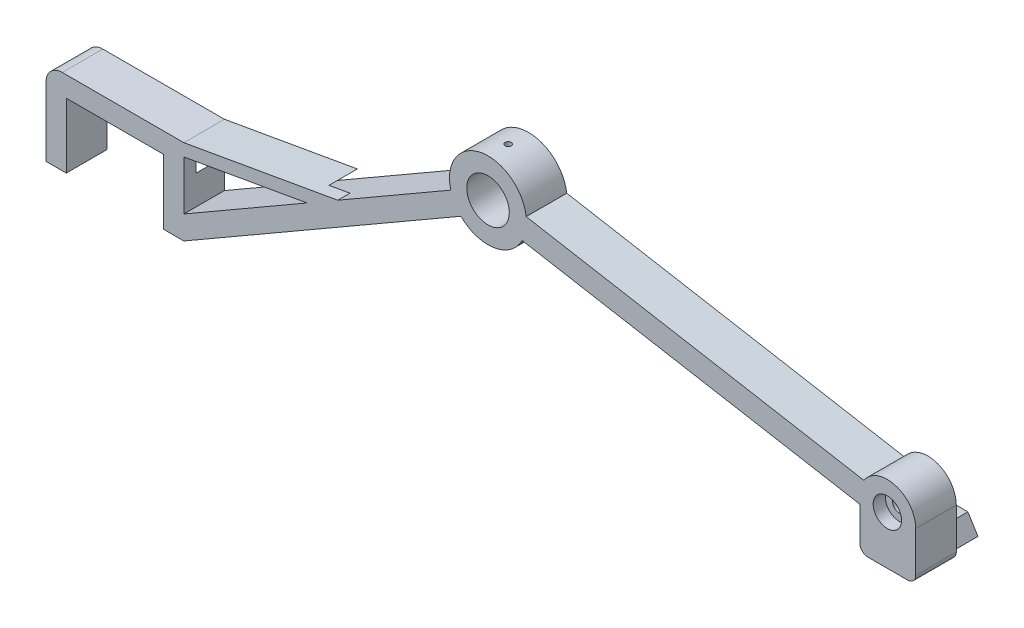
from build123d import *

# Parameters (mm, degrees)
SKICA1_R                 = 5.25
P_IDAT_VYSUNUT_M1_DEPTH  = 5
ZAOBLIT1_R               = 4
P_IDAT_VYSUNUT_M3_DEPTH  = 5
SKICA5_R                 = 4.25
SKICA5_R_2               = 1.75
P_IDAT_VYSUNUT_M4_DEPTH  = 1
SKICA8_R                 = 1.05
ODEBRAT_VYSUNUT_M3_DEPTH = 6
ODEBRAT_VYSUNUT_M4_DEPTH = 7
ODEBRAT_START            = -10
SKICA2_R                 = 1.75
ODEBRAT_VYSUNUT_M5_DEPTH = 10
SKICA10_R                = 3.5
ODEBRAT_VYSUNUT_M6_DEPTH = 3
ODEBRAT_START_2          = 50
SKICA11_R                = 0.75
ODEBRAT_VYSUNUT_M7_DEPTH = 10
P_IDAT_VYSUNUT_M5_DEPTH  = 10
P_IDAT_VYSUNUT_M6_DEPTH  = 8
ZAOBLIT2_R               = 2
ODEBRAT_START_3          = -7
ODEBRAT_VYSUNUT_M8_DEPTH = 7
SCALE1_SCALE             = 8


with BuildPart() as part:
    # Skica1 → Přidat vysunutím1 (new, symmetric)
    with BuildSketch(Plane.XY):
        with BuildLine():
            Line((0, 0), (0, 16))
            Line((0, 16), (24, 16))
            Line((24, 16), (24, 0))
            Line((24, 0), (29, 0))
            Line((29, 0), (97.312746067, 39.440382331))
            ThreePointArc((97.312746067, 39.440382331), (105.473420704, 36.802978572), (112.433277726, 41.81425579))
            Line((112.433277726, 41.81425579), (195.687578405, 27.134276321))
            ThreePointArc((195.687578405, 27.134276321), (209.374429572, 27.607666525), (196.674905514, 32.733686604))
            Line((196.674905514, 32.733686604), (113.420604835, 47.413666074))
            ThreePointArc((113.420604835, 47.413666074), (102.174688824, 55.511016714), (94.812746067, 43.77050935))
            Line((94.812746067, 43.77050935), (29, 5.773502692))
            Line((29, 5.773502692), (29, 21))
            Line((29, 21), (-5, 21))
            Line((-5, 21), (-5, 0))
            Line((-5, 0), (0, 0))
        make_face()
        with Locations((104, 46.188021535)):
            Circle(SKICA1_R, mode=Mode.SUBTRACT)
    extrude(amount=P_IDAT_VYSUNUT_M1_DEPTH, both=True)

    # Zaoblit1
    zaoblit1_edges = [part.edges().sort_by_distance(p)[0] for p in [
        (-5, 21, 0),
    ]]
    fillet(zaoblit1_edges, radius=ZAOBLIT1_R)

    # Skica4 → Přidat vysunutím3 (add, symmetric)
    with BuildSketch(Plane.XY):
        Polygon((29, 21), (66.969109888, 27.694978507), (59.37284323, 23.309271907), (29, 17.953720164), align=None)
    extrude(amount=P_IDAT_VYSUNUT_M3_DEPTH, both=True)

    # Skica5 → Přidat vysunutím4 (add)
    with BuildSketch(Plane.XY.offset(5)):
        with Locations((202.480775301, 28.823203768)):
            Circle(SKICA5_R)
        with Locations((202.480775301, 28.823203768)):
            Circle(SKICA5_R_2, mode=Mode.SUBTRACT)
    extrude(amount=P_IDAT_VYSUNUT_M4_DEPTH)

    # Skica8 → Odebrat vysunutím3 (cut)
    with BuildSketch(Plane.XZ):
        with Locations(Location((-1.5, 0, 0), (0, 0, 270))):
            Circle(SKICA8_R)
        with Locations(Location((25.5, 0, 0), (0, 0, 270))):
            Circle(SKICA8_R)
    extrude(amount=-ODEBRAT_VYSUNUT_M3_DEPTH, mode=Mode.SUBTRACT)

    # Skica9 → Odebrat vysunutím4 (cut)
    with BuildSketch(Plane.XY.offset(5)):
        Polygon((24, 16), (29, 16), (29, 13), (24, 8), align=None)
    extrude(amount=-ODEBRAT_VYSUNUT_M4_DEPTH, mode=Mode.SUBTRACT)

    # Skica2 → Odebrat vysunutím5 (cut)
    with BuildSketch(Plane.XY.offset(5).offset(ODEBRAT_START)):
        with Locations((202.480775301, 28.823203768)):
            Circle(SKICA2_R)
    extrude(amount=ODEBRAT_VYSUNUT_M5_DEPTH, mode=Mode.SUBTRACT)

    # Skica10 → Odebrat vysunutím6 (cut)
    with BuildSketch(Plane(origin=(0, 0, -5), x_dir=(-1, 0, 0), z_dir=(0, 0, -1))):
        with Locations((-202.480775301, 28.823203768)):
            Circle(SKICA10_R)
    extrude(amount=-ODEBRAT_VYSUNUT_M6_DEPTH, mode=Mode.SUBTRACT)


with BuildPart() as body_2:
    # Zrcadlit1: mirrored copy
    add(part.part.mirror(Plane(origin=(93.65445241, 28.310869093, -5), x_dir=(1, 0, 0), z_dir=(0, 0, -1))))

    # Skica11 → Odebrat vysunutím7 (cut)
    with BuildSketch(Plane(origin=(0, 0, 0), x_dir=(1, 0, 0), z_dir=(0, 1, 0)).offset(ODEBRAT_START_2)):
        with Locations(Location((103.960302418, 10, 0), (0, 0, 90))):
            Circle(SKICA11_R)
    extrude(amount=ODEBRAT_VYSUNUT_M7_DEPTH, mode=Mode.SUBTRACT)

    # Skica12 → Přidat vysunutím5 (add)
    with BuildSketch(Plane(origin=(0, 0, -15), x_dir=(-1, 0, 0), z_dir=(0, 0, -1))):
        with BuildLine():
            Line((-209.480775301, 28.823203768), (-209.480775301, 16.823203768))
            Line((-209.480775301, 16.823203768), (-195.687578405, 16.823203768))
            Line((-195.687578405, 16.823203768), (-195.687578405, 27.134276321))
            ThreePointArc((-195.687578405, 27.134276321), (-203.331546047, 21.875096894), (-209.480775301, 28.823203768))
        make_face()
    extrude(amount=-P_IDAT_VYSUNUT_M5_DEPTH)

    # Skica13 → Přidat vysunutím6 (add)
    with BuildSketch(Plane(origin=(0, 0, -15), x_dir=(-1, 0, 0), z_dir=(0, 0, -1))):
        Polygon((-204.334176853, 20.823203768), (-200.834176853, 20.823203768), (-198.334176853, 16.823203768), (-206.834176853, 16.823203768), align=None)
    extrude(amount=P_IDAT_VYSUNUT_M6_DEPTH)

    # Zaoblit2
    zaoblit2_edges = [body_2.edges().sort_by_distance(p)[0] for p in [
        (195.687578405, 16.823203768, -10),
        (209.480775301, 16.823203768, -10),
    ]]
    fillet(zaoblit2_edges, radius=ZAOBLIT2_R)

    # Skica14 → Odebrat vysunutím8 (cut)
    with BuildSketch(Plane(origin=(0, 0, -15), x_dir=(-1, 0, 0), z_dir=(0, 0, -1)).offset(ODEBRAT_START_3)):
        Polygon((-59.37284323, 23.309271907), (-66.969109888, 27.694978507), (-61.786216453, 26.781094556), (-54.189949795, 22.395387956), align=None)
    extrude(amount=ODEBRAT_VYSUNUT_M8_DEPTH, mode=Mode.SUBTRACT)


with BuildPart() as body_2_1:
    # Scale1: scaled about (103.22707652, 28.04115128, -10.107869414)
    add(body_2.part.scale(SCALE1_SCALE).moved(Location((-722.58953564, -196.28805896, 70.755085898))))


solid = body_2_1.part
